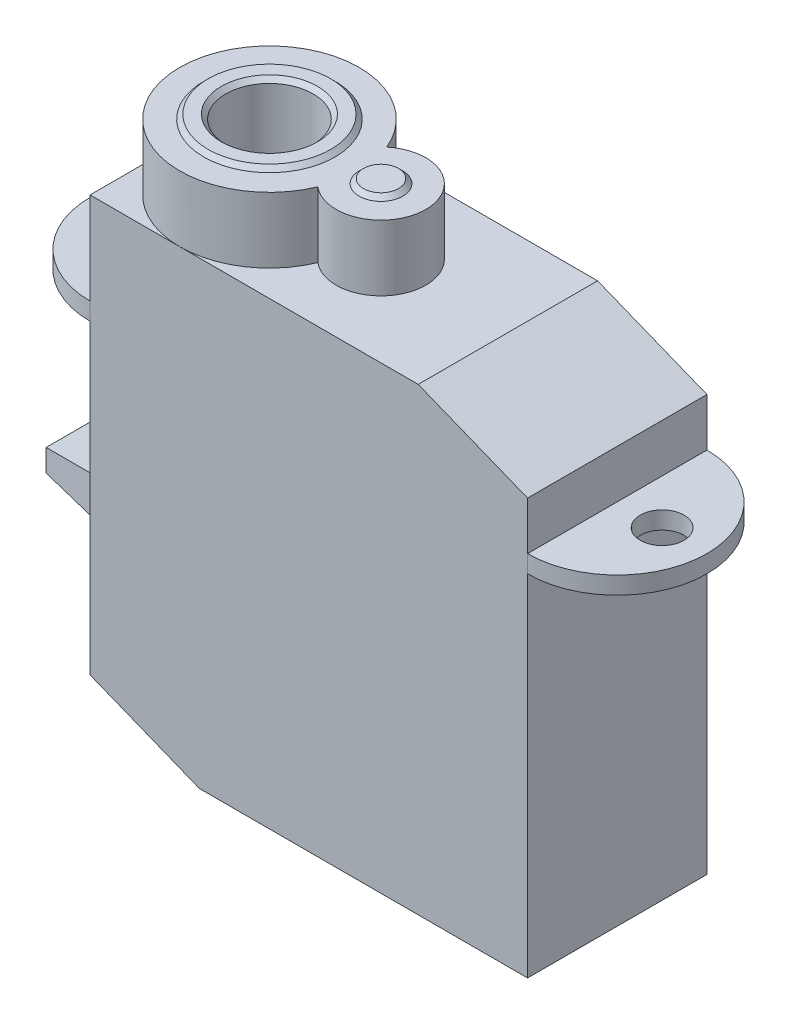
from build123d import *

# Parameters (mm, degrees)
SKETCH1_W                      = 20
SKETCH1_H                      = 8.2
BOSS_EXTRUDE1_DEPTH            = 21
SKETCH2_W                      = 8.2
SKETCH2_H                      = 0.8
BOSS_EXTRUDE2_DEPTH            = 5
SKETCH3_W                      = 8.2
SKETCH3_H                      = 0.8
BOSS_EXTRUDE3_DEPTH            = 5
CUT_EXTRUDE1_REACH             = 35.664
CUT_EXTRUDE2_REACH             = 33.217
F_2_0_2_DIAMETER_HOLE1_D       = 2
BOSS_EXTRUDE6_DEPTH            = 3
CUT_EXTRUDE4_REACH             = 36.986
SKETCH12_W                     = 6.2
SKETCH12_H                     = 2
BOSS_EXTRUDE7_DEPTH            = 3.5
BOSS_EXTRUDE7_TAPER            = 8
SKETCH15_R                     = 2
CUT_EXTRUDE5_DEPTH             = 5
SKETCH17_R                     = 3
SKETCH17_R_2                   = 2
BOSS_EXTRUDE10_DEPTH           = 0.2
BOSS_EXTRUDE10_DRAFT           = 45
SKETCH17_R_3                   = 1
BOSS_EXTRUDE10_PROFILE_2_DEPTH = 0.2
BOSS_EXTRUDE10_PROFILE_2_DRAFT = 45


with BuildPart() as part:
    # Sketch1 → Boss-Extrude1 (new body)
    with BuildSketch(Plane(origin=(0, 0, 0), x_dir=(1, 0, 0), z_dir=(0, 1, 0))):
        with Locations((10, -4.1)):
            Rectangle(SKETCH1_W, SKETCH1_H)
    extrude(amount=BOSS_EXTRUDE1_DEPTH)

    # Sketch2 → Boss-Extrude2 (add)
    with BuildSketch(Plane(origin=(20, 0, 0), x_dir=(0, 0, -1), z_dir=(1, 0, 0))):
        with Locations((-4.1, 16.4)):
            Rectangle(SKETCH2_W, SKETCH2_H)
    extrude(amount=BOSS_EXTRUDE2_DEPTH)

    # Sketch3 → Boss-Extrude3 (add)
    with BuildSketch(Plane.ZY):
        with Locations((4.1, 16.4)):
            Rectangle(SKETCH3_W, SKETCH3_H)
    extrude(amount=BOSS_EXTRUDE3_DEPTH)

    # Sketch4 → Cut-Extrude1 (cut, up to next)
    with BuildSketch(Plane.XY.offset(8.2), mode=Mode.PRIVATE) as cut_extrude1_sk1:
        Polygon((20, 19), (15, 21), (20, 21), align=None)
    cut_extrude1_tool1 = extrude(cut_extrude1_sk1.sketch, amount=-CUT_EXTRUDE1_REACH, mode=Mode.PRIVATE) & part.part
    add(cut_extrude1_tool1.solids().sort_by_distance((18.333333, 20.333333, 8.2))[0], mode=Mode.SUBTRACT)

    # Sketch8 → Cut-Extrude2 (cut, up to next)
    with BuildSketch(Plane(origin=(0, 16.8, 0), x_dir=(1, 0, 0), z_dir=(0, 1, 0)), mode=Mode.PRIVATE) as cut_extrude2_sk1:
        with BuildLine():
            Line((-5, 0), (0, 0))
            ThreePointArc((0, 0), (-4.1, -4.1), (0, -8.2))
            Line((0, -8.2), (-5, -8.2))
            Line((-5, -8.2), (-5, 0))
        make_face()
    cut_extrude2_tool1 = extrude(cut_extrude2_sk1.sketch, amount=-CUT_EXTRUDE2_REACH, mode=Mode.PRIVATE) & part.part
    # Sketch8 → Cut-Extrude2 (cut, up to next)
    with BuildSketch(Plane(origin=(0, 16.8, 0), x_dir=(1, 0, 0), z_dir=(0, 1, 0)), mode=Mode.PRIVATE) as cut_extrude2_sk2:
        with BuildLine():
            Line((20, -8.2), (25, -8.2))
            Line((25, -8.2), (25, 0))
            Line((25, 0), (20, 0))
            ThreePointArc((20, 0), (24.1, -4.1), (20, -8.2))
        make_face()
    cut_extrude2_tool2 = extrude(cut_extrude2_sk2.sketch, amount=-CUT_EXTRUDE2_REACH, mode=Mode.PRIVATE) & part.part
    add(cut_extrude2_tool1.solids().sort_by_distance((-2.5, 16.8, 8.103958))[0], mode=Mode.SUBTRACT)
    add(cut_extrude2_tool2.solids().sort_by_distance((24.196042, 16.8, 4.1))[0], mode=Mode.SUBTRACT)

    # Ø2.0 (2) Diameter Hole1 (through all)
    with Locations(Plane(origin=(-2.05, 16.8, 4.1), x_dir=(0, 0, 1), z_dir=(0, 1, 0))):
        with Locations((0, 0), (0, 24.1)):
            Hole(F_2_0_2_DIAMETER_HOLE1_D / 2)

    # Sketch10 → Boss-Extrude6 (add)
    with BuildSketch(Plane(origin=(0, 21, 0), x_dir=(1, 0, 0), z_dir=(0, 1, 0))):
        with BuildLine():
            ThreePointArc((7.886029412, -2.526474883), (0, -4.1), (7.886029412, -5.673525117))
            ThreePointArc((7.886029412, -5.673525117), (11.25, -4.1), (7.886029412, -2.526474883))
        make_face()
    extrude(amount=BOSS_EXTRUDE6_DEPTH)

    # Sketch11 → Cut-Extrude4 (cut, up to next)
    with BuildSketch(Plane.XY.offset(8.2), mode=Mode.PRIVATE) as cut_extrude4_sk1:
        Polygon((0, 0), (0, 2), (5, 0), align=None)
    cut_extrude4_tool1 = extrude(cut_extrude4_sk1.sketch, amount=-CUT_EXTRUDE4_REACH, mode=Mode.PRIVATE) & part.part
    add(cut_extrude4_tool1.solids().sort_by_distance((1.666667, 0.666667, 8.2))[0], mode=Mode.SUBTRACT)

    # Sketch12 → Boss-Extrude7 (add)
    with BuildSketch(Plane.ZY):
        with Locations((4.1, 8)):
            Rectangle(SKETCH12_W, SKETCH12_H)
    extrude(amount=BOSS_EXTRUDE7_DEPTH, taper=BOSS_EXTRUDE7_TAPER)

    # Sketch15 → Cut-Extrude5 (cut)
    with BuildSketch(Plane(origin=(0, 24, 0), x_dir=(1, 0, 0), z_dir=(0, 1, 0))):
        with Locations(Location((4.1, -4.1, 0), (0, 0, 270))):
            Circle(SKETCH15_R)
    extrude(amount=-CUT_EXTRUDE5_DEPTH, mode=Mode.SUBTRACT)


with BuildPart() as boss_extrude10_tool:
    # Sketch17 → Boss-Extrude10 (with draft: the straight prism first)
    with BuildSketch(Plane(origin=(0, 24, 0), x_dir=(1, 0, 0), z_dir=(0, 1, 0))):
        with Locations((4.1, -4.1)):
            Circle(SKETCH17_R)
        with Locations(Location((4.1, -4.1, 0), (0, 0, 270))):
            Circle(SKETCH17_R_2, mode=Mode.SUBTRACT)
    extrude(amount=BOSS_EXTRUDE10_DEPTH)
    # Boss-Extrude10: the draft: its side faces are tilted about the plane it starts from
    boss_extrude10_sides = [boss_extrude10_tool.faces().sort_by_distance(p)[0] for p in [
        (1.1, 24.1, 4.1),
        (4.1, 24.1, 2.1),
    ]]
    draft(boss_extrude10_sides, Plane(origin=(0, 24, 0), x_dir=(1, 0, 0), z_dir=(0, 1, 0)), BOSS_EXTRUDE10_DRAFT)


with BuildPart() as part_1:
    add(part.part)

    # Boss-Extrude10: add boss_extrude10_tool
    add(boss_extrude10_tool.part)


with BuildPart() as boss_extrude10_profile_2_tool:
    # Sketch17 → Boss-Extrude10 profile 2 (with draft: the straight prism first)
    with BuildSketch(Plane(origin=(0, 24, 0), x_dir=(1, 0, 0), z_dir=(0, 1, 0))):
        with Locations((9.2, -4.1)):
            Circle(SKETCH17_R_3)
    extrude(amount=BOSS_EXTRUDE10_PROFILE_2_DEPTH)
    # Boss-Extrude10 profile 2: the draft: its side faces are tilted about the plane it starts from
    boss_extrude10_profile_2_sides = [boss_extrude10_profile_2_tool.faces().sort_by_distance(p)[0] for p in [
        (8.2, 24.1, 4.1),
    ]]
    draft(boss_extrude10_profile_2_sides, Plane(origin=(0, 24, 0), x_dir=(1, 0, 0), z_dir=(0, 1, 0)), BOSS_EXTRUDE10_PROFILE_2_DRAFT)


with BuildPart() as part_2:
    add(part_1.part)

    # Boss-Extrude10 profile 2: add boss_extrude10_profile_2_tool
    add(boss_extrude10_profile_2_tool.part)


solid = part_2.part
